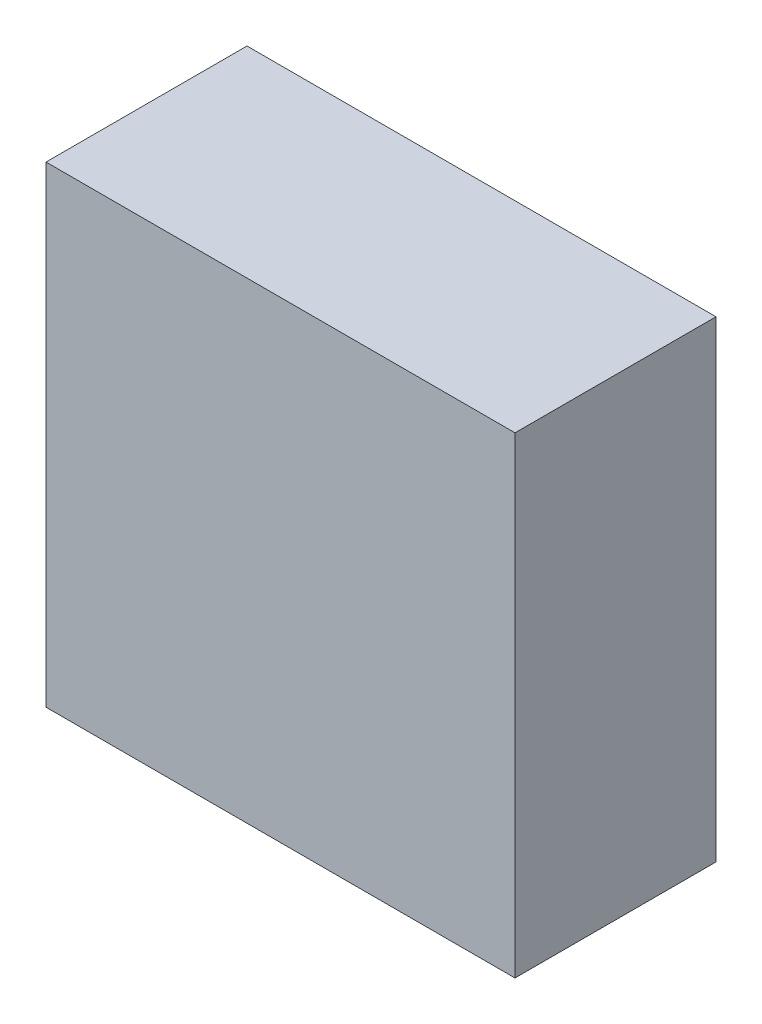
from build123d import *

# Parameters (mm, degrees)
SKETCH1_W           = 88.9
SKETCH1_H           = 38.1
BOSS_EXTRUDE1_DEPTH = 89.5


with BuildPart() as part:
    # Sketch1 → Boss-Extrude1 (new body)
    with BuildSketch(Plane(origin=(0, 0, 0), x_dir=(1, 0, 0), z_dir=(0, 1, 0))):
        Rectangle(SKETCH1_W, SKETCH1_H)
    extrude(amount=BOSS_EXTRUDE1_DEPTH)


solid = part.part
